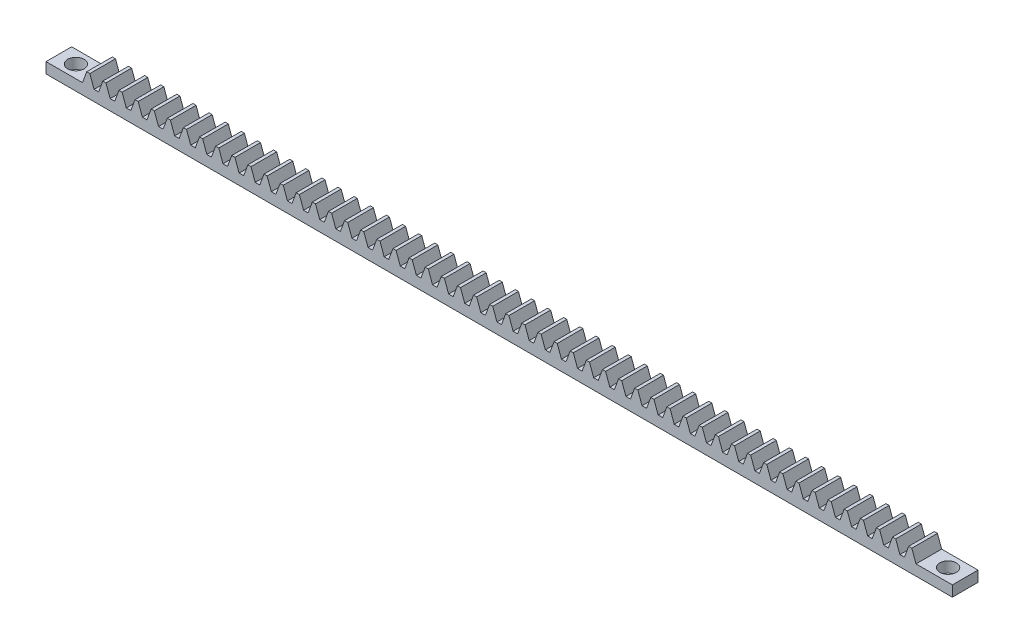
from build123d import *

# Parameters (mm, degrees)
BLANKSKE_W          = 147
BLANKSKE_H          = 2.9
BLANK_DEPTH         = 4.5
TOOTHCUTSIM_DEPTH   = 148.097450692
TEETHCUTS_COUNT     = 53
TEETHCUTS_PITCH     = 2.827433385
SKETCH1_W           = 4.5
SKETCH1_H           = 0.875
BOSS_EXTRUDE1_DEPTH = 6
SKETCH2_W           = 4.5
SKETCH2_H           = 0.875
BOSS_EXTRUDE2_DEPTH = 6
SKETCH3_W           = 159
SKETCH3_H           = 4.5
BOSS_EXTRUDE3_DEPTH = 1
CUT_EXTRUDE1_REACH  = 155.08
SKETCH4_R           = 1.45


with BuildPart() as part:
    # BlankSke → Blank (new body)
    with BuildSketch(Plane.XY):
        with Locations((73.5, 1.45)):
            Rectangle(BLANKSKE_W, BLANKSKE_H)
    extrude(amount=-BLANK_DEPTH)

    # TooCutSkeSim → ToothCutSim (cut, through all)
    with BuildSketch(Plane.XY):
        Polygon((0.399391833, 0.875), (-0.399391833, 0.875), (-1.145676401, 2.9254), (1.145676401, 2.9254), align=None)
    toothcutsim = extrude(amount=-TOOTHCUTSIM_DEPTH, mode=Mode.SUBTRACT)

    # TeethCuts: ToothCutSim ×53
    with Locations(*[(i * TEETHCUTS_PITCH, 0, 0) for i in range(1, TEETHCUTS_COUNT)]):
        add(toothcutsim, mode=Mode.SUBTRACT)

    # Sketch1 → Boss-Extrude1 (add)
    with BuildSketch(Plane(origin=(147, 0, 0), x_dir=(0, 0, -1), z_dir=(1, 0, 0))):
        with Locations((2.25, 0.4375)):
            Rectangle(SKETCH1_W, SKETCH1_H)
    extrude(amount=BOSS_EXTRUDE1_DEPTH)

    # Sketch2 → Boss-Extrude2 (add)
    with BuildSketch(Plane.ZY):
        with Locations((-2.25, 0.4375)):
            Rectangle(SKETCH2_W, SKETCH2_H)
    extrude(amount=BOSS_EXTRUDE2_DEPTH)

    # Sketch3 → Boss-Extrude3 (add)
    with BuildSketch(Plane.XZ):
        with Locations((73.5, -2.25)):
            Rectangle(SKETCH3_W, SKETCH3_H)
    extrude(amount=BOSS_EXTRUDE3_DEPTH)

    # Sketch4 → Cut-Extrude1 (cut, up to next)
    with BuildSketch(Plane(origin=(0, 0.875, 0), x_dir=(1, 0, 0), z_dir=(0, 1, 0)), mode=Mode.PRIVATE) as cut_extrude1_sk1:
        with Locations(Location((150, 2.25, 0), (0, 0, 270))):
            Circle(SKETCH4_R)
    cut_extrude1_tool1 = extrude(cut_extrude1_sk1.sketch, amount=-CUT_EXTRUDE1_REACH, mode=Mode.PRIVATE) & part.part
    # Sketch4 → Cut-Extrude1 (cut, up to next)
    with BuildSketch(Plane(origin=(0, 0.875, 0), x_dir=(1, 0, 0), z_dir=(0, 1, 0)), mode=Mode.PRIVATE) as cut_extrude1_sk2:
        with Locations(Location((-3, 2.25, 0), (0, 0, 270))):
            Circle(SKETCH4_R)
    cut_extrude1_tool2 = extrude(cut_extrude1_sk2.sketch, amount=-CUT_EXTRUDE1_REACH, mode=Mode.PRIVATE) & part.part
    add(cut_extrude1_tool1.solids().sort_by_distance((150, 0.875, -2.25))[0], mode=Mode.SUBTRACT)
    add(cut_extrude1_tool2.solids().sort_by_distance((-3, 0.875, -2.25))[0], mode=Mode.SUBTRACT)


solid = part.part
